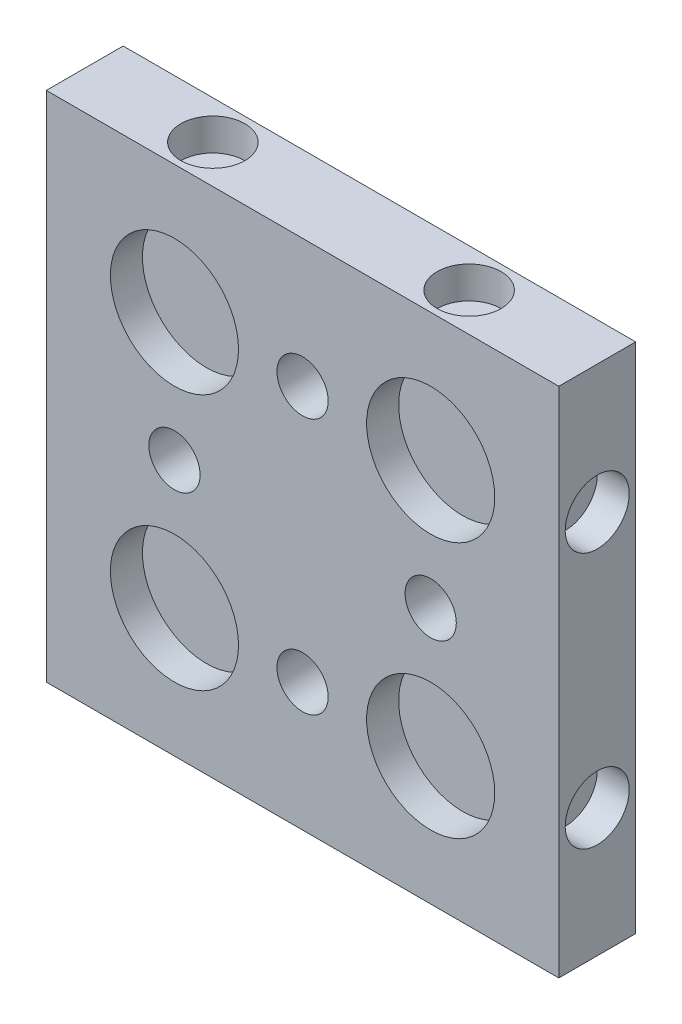
from build123d import *

# Parameters (mm, degrees)
SKETCH1_W           = 50.8
SKETCH1_H           = 50.8
BOSS_EXTRUDE1_DEPTH = 7.62
SKETCH3_R           = 2.54
CUT_EXTRUDE1_DEPTH  = 6.35
SKETCH4_R           = 6.35
CUT_EXTRUDE2_DEPTH  = 3.175
SKETCH5_R           = 3.175
CUT_EXTRUDE3_DEPTH  = 3.175
SKETCH6_R           = 3.175
CUT_EXTRUDE4_DEPTH  = 3.175
CUT_EXTRUDE5_START  = -3.175
SKETCH7_R           = 3.175
CUT_EXTRUDE5_DEPTH  = 3.175
CUT_EXTRUDE6_START  = -3.175
SKETCH8_R           = 3.175
CUT_EXTRUDE6_DEPTH  = 3.175


with BuildPart() as part:
    # Sketch1 → Boss-Extrude1 (new body)
    with BuildSketch(Plane.XY):
        with Locations((4.049275362, 0.552173913)):
            Rectangle(SKETCH1_W, SKETCH1_H)
    extrude(amount=BOSS_EXTRUDE1_DEPTH)

    # Sketch3 → Cut-Extrude1 (cut)
    with BuildSketch(Plane.XY.offset(7.62)):
        with Locations((-8.650724638, 0.552173913)):
            Circle(SKETCH3_R)
        with Locations((4.049275362, 13.252173913)):
            Circle(SKETCH3_R)
        with Locations((4.049275362, -12.147826087)):
            Circle(SKETCH3_R)
        with Locations((16.749275362, 0.552173913)):
            Circle(SKETCH3_R)
    extrude(amount=-CUT_EXTRUDE1_DEPTH, mode=Mode.SUBTRACT)

    # Sketch4 → Cut-Extrude2 (cut)
    with BuildSketch(Plane.XY.offset(7.62)):
        with Locations((-8.650724638, 13.252173913)):
            Circle(SKETCH4_R)
        with Locations((16.749275362, 13.252173913)):
            Circle(SKETCH4_R)
        with Locations((16.749275362, -12.147826087)):
            Circle(SKETCH4_R)
        with Locations((-8.650724638, -12.147826087)):
            Circle(SKETCH4_R)
    extrude(amount=-CUT_EXTRUDE2_DEPTH, mode=Mode.SUBTRACT)

    # Sketch5 → Cut-Extrude3 (cut)
    with BuildSketch(Plane(origin=(29.449275362, 0, 0), x_dir=(0, 0, -1), z_dir=(1, 0, 0))):
        with Locations(Location((-3.81, 13.252173913, 0), (0, 0, 90))):
            Circle(SKETCH5_R)
        with Locations(Location((-3.81, -12.147826087, 0), (0, 0, 90))):
            Circle(SKETCH5_R)
    extrude(amount=-CUT_EXTRUDE3_DEPTH, mode=Mode.SUBTRACT)

    # Sketch6 → Cut-Extrude4 (cut)
    with BuildSketch(Plane(origin=(0, -24.847826087, 0), x_dir=(-1, 0, 0), z_dir=(0, -1, 0))):
        with Locations(Location((8.650724638, -3.81, 0), (0, 0, 90))):
            Circle(SKETCH6_R)
        with Locations(Location((-16.749275362, -3.81, 0), (0, 0, 90))):
            Circle(SKETCH6_R)
    extrude(amount=-CUT_EXTRUDE4_DEPTH, mode=Mode.SUBTRACT)

    # Sketch7 → Cut-Extrude5 (cut)
    with BuildSketch(Plane.ZY.offset(21.350724638).offset(CUT_EXTRUDE5_START)):
        with Locations(Location((3.81, 13.252173913, 0), (0, 0, 90))):
            Circle(SKETCH7_R)
        with Locations(Location((3.81, -12.147826087, 0), (0, 0, 90))):
            Circle(SKETCH7_R)
    extrude(amount=CUT_EXTRUDE5_DEPTH, mode=Mode.SUBTRACT)

    # Sketch8 → Cut-Extrude6 (cut)
    with BuildSketch(Plane(origin=(0, 25.952173913, 0), x_dir=(1, 0, 0), z_dir=(0, 1, 0)).offset(CUT_EXTRUDE6_START)):
        with Locations(Location((-8.650724638, -3.81, 0), (0, 0, 90))):
            Circle(SKETCH8_R)
        with Locations(Location((16.749275362, -3.81, 0), (0, 0, 90))):
            Circle(SKETCH8_R)
    extrude(amount=CUT_EXTRUDE6_DEPTH, mode=Mode.SUBTRACT)


solid = part.part
